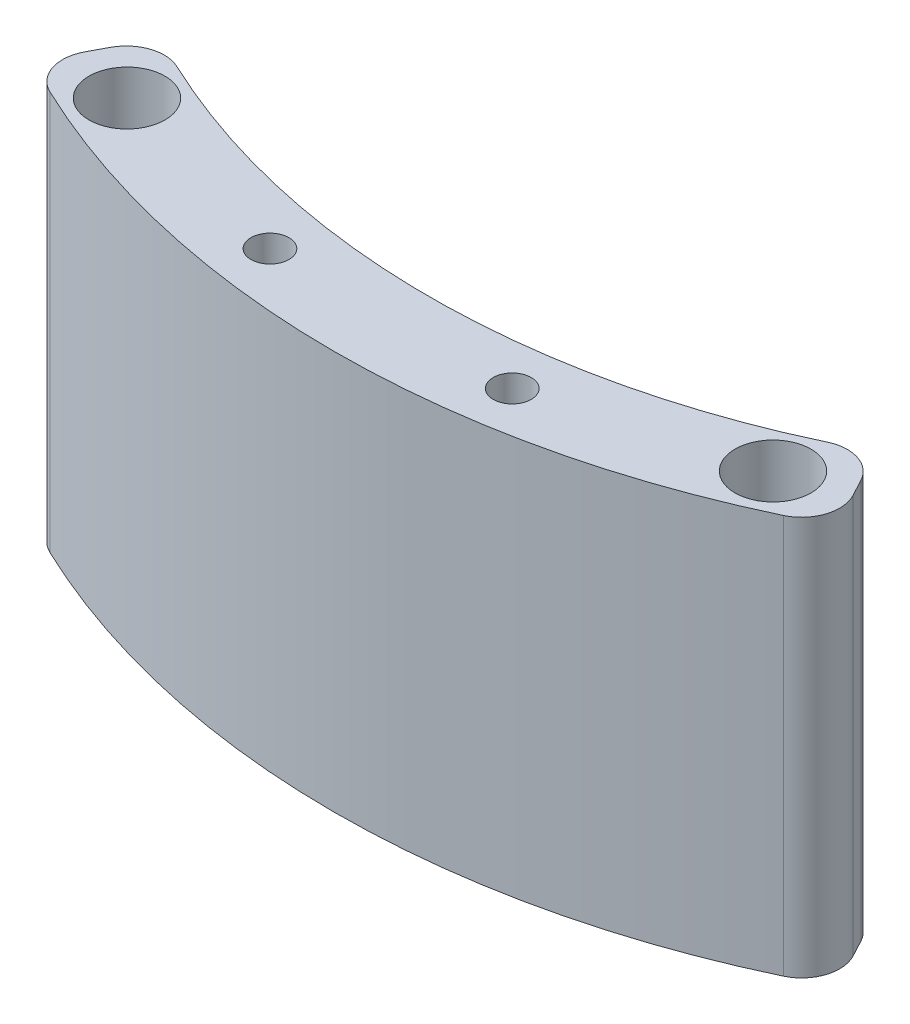
from build123d import *

# Parameters (mm, degrees)
BOSS_EXTRUDE1_DEPTH = 42
FILLET1_R           = 4
SKETCH2_R           = 4
CUT_EXTRUDE1_DEPTH  = 42
SKETCH3_R           = 2
CUT_EXTRUDE2_DEPTH  = 42


with BuildPart() as part:
    # Sketch1 → Boss-Extrude1 (new body)
    with BuildSketch(Plane(origin=(0, 0, 0), x_dir=(1, 0, 0), z_dir=(0, 1, 0))):
        with BuildLine():
            Line((-37.647058824, 19.411764706), (-42.352941176, 10.588235294))
            ThreePointArc((-42.352941176, 10.588235294), (0, 0), (42.352941176, 10.588235294))
            Line((42.352941176, 10.588235294), (37.647058824, 19.411764706))
            ThreePointArc((37.647058824, 19.411764706), (0, 10), (-37.647058824, 19.411764706))
        make_face()
    extrude(amount=BOSS_EXTRUDE1_DEPTH)

    # Fillet1
    fillet1_edges = [part.edges().sort_by_distance(p)[0] for p in [
        (37.647058824, 21, -19.411764706),
        (42.352941176, 21, -10.588235294),
        (-42.352941176, 21, -10.588235294),
        (-37.647058824, 21, -19.411764706),
    ]]
    fillet(fillet1_edges, radius=FILLET1_R)

    # Sketch2 → Cut-Extrude1 (cut)
    with BuildSketch(Plane(origin=(0, 42, 0), x_dir=(1, 0, 0), z_dir=(0, 1, 0))):
        with Locations(Location((-34, 12.2, 0), (0, 0, 270))):
            Circle(SKETCH2_R)
        with Locations(Location((34, 12.2, 0), (0, 0, 270))):
            Circle(SKETCH2_R)
    extrude(amount=-CUT_EXTRUDE1_DEPTH, mode=Mode.SUBTRACT)

    # Sketch3 → Cut-Extrude2 (cut)
    with BuildSketch(Plane(origin=(0, 42, 0), x_dir=(1, 0, 0), z_dir=(0, 1, 0))):
        with Locations(Location((-12.75, 6, 0), (0, 0, 270))):
            Circle(SKETCH3_R)
        with Locations(Location((12.75, 6, 0), (0, 0, 270))):
            Circle(SKETCH3_R)
    extrude(amount=-CUT_EXTRUDE2_DEPTH, mode=Mode.SUBTRACT)


solid = part.part
